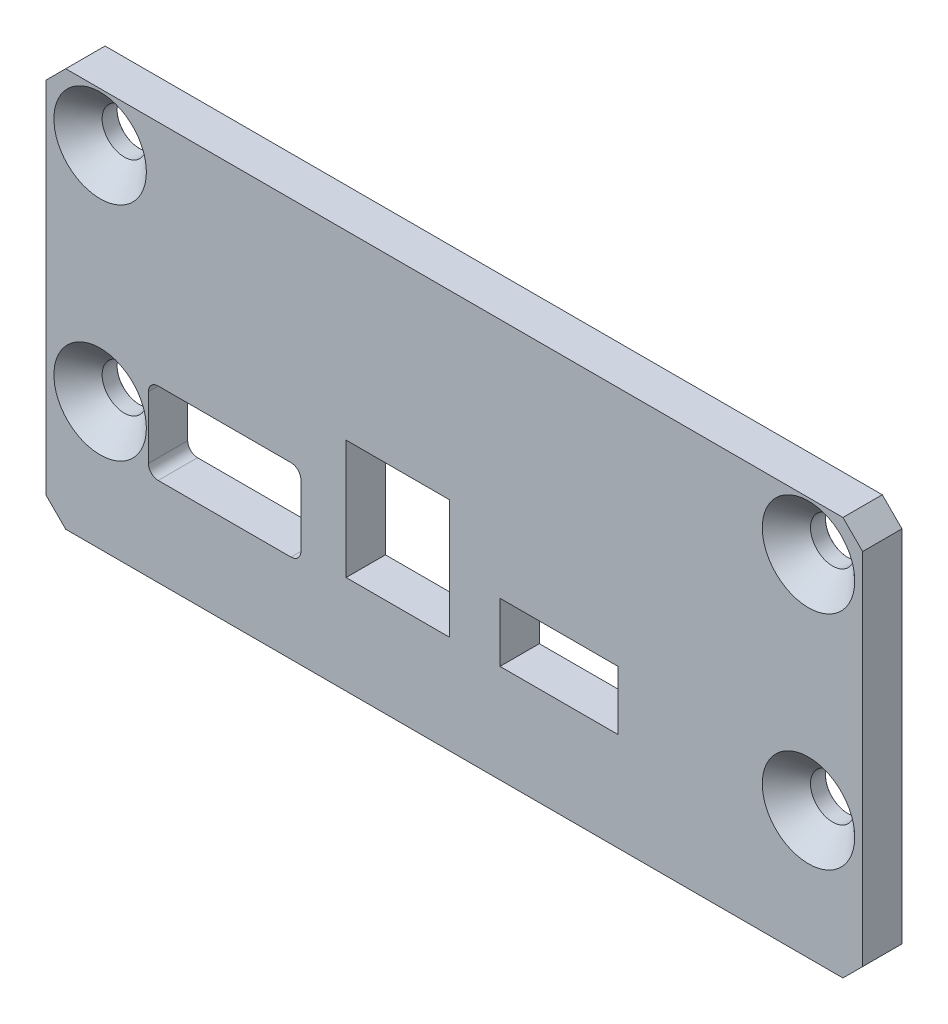
from build123d import *

# Parameters (mm, degrees)
ESQUISSE1_W                                 = 15.5
ESQUISSE1_H                                 = 8.312963114
ESQUISSE1_W_2                               = 10.5
ESQUISSE1_H_2                               = 12.1
ESQUISSE1_W_3                               = 12
ESQUISSE1_H_3                               = 6
BOSS_EXTRU_1_DEPTH                          = 4
FRAISAGE_POUR_VIS_T_TE_FRAIS_E_M41_AT_COUNT = 2
FRAISAGE_POUR_VIS_T_TE_FRAIS_E_M41_AT_PITCH = 22.54
FRAISAGE_POUR_VIS_T_TE_FRAIS_E_M41_2_COUNT  = 2
FRAISAGE_POUR_VIS_T_TE_FRAIS_E_M41_2_PITCH  = 75.445686424
FRAISAGE_POUR_VIS_T_TE_FRAIS_E_M41_3_COUNT  = 2
FRAISAGE_POUR_VIS_T_TE_FRAIS_E_M41_3_PITCH  = 72
CONG_1_R                                    = 1


with BuildPart() as part:
    # Esquisse1 → Boss.-Extru.1 (new body)
    with BuildSketch(Plane.XY):
        Polygon((-35.056497175, 38.54), (-35.056497175, 2), (-33.056497175, 0), (45.943502825, 0), (47.943502825, 2), (47.943502825, 38.54), (45.943502825, 40.54), (-33.056497175, 40.54), align=None)
        with Locations((-16.906497175, 13.156481557)):
            Rectangle(ESQUISSE1_W, ESQUISSE1_H, mode=Mode.SUBTRACT)
        with Locations((0.693502825, 16.05)):
            Rectangle(ESQUISSE1_W_2, ESQUISSE1_H_2, mode=Mode.SUBTRACT)
        with Locations((17.086336796, 13)):
            Rectangle(ESQUISSE1_W_3, ESQUISSE1_H_3, mode=Mode.SUBTRACT)
    extrude(amount=BOSS_EXTRU_1_DEPTH)

    # Esquisse4 → Fraisage pour vis à tête fraisée M41 (revolve, cut)
    with BuildSketch(Plane(origin=(-29.556497175, 35.54, 4), x_dir=(0, -1, 0), z_dir=(1, 0, 0))):
        Polygon((0, 0), (0, 4), (2.275, 4), (2.25, 3.975), (2.25, 2.45), (4.7, 0), align=None)
    fraisage_pour_vis_t_te_frais_e_m41 = revolve(axis=Axis((-29.556497175, 35.54, 10.35), (0, 0, -1)), mode=Mode.SUBTRACT)

    # Fraisage pour vis à tête fraisée M41 at: Fraisage pour vis à tête fraisée M41 ×2
    with Locations(*[(0, -i * FRAISAGE_POUR_VIS_T_TE_FRAIS_E_M41_AT_PITCH, 0) for i in range(1, FRAISAGE_POUR_VIS_T_TE_FRAIS_E_M41_AT_COUNT)]):
        add(fraisage_pour_vis_t_te_frais_e_m41, mode=Mode.SUBTRACT)

    # Fraisage pour vis _ t_te frais_e M41 2: Fraisage pour vis à tête fraisée M41 ×2
    with Locations(*[Vector(0.9543289141183242, -0.29875796839204205, 0) * (i * FRAISAGE_POUR_VIS_T_TE_FRAIS_E_M41_2_PITCH) for i in range(1, FRAISAGE_POUR_VIS_T_TE_FRAIS_E_M41_2_COUNT)]):
        add(fraisage_pour_vis_t_te_frais_e_m41, mode=Mode.SUBTRACT)

    # Fraisage pour vis _ t_te frais_e M41 3: Fraisage pour vis à tête fraisée M41 ×2
    with Locations(*[(i * FRAISAGE_POUR_VIS_T_TE_FRAIS_E_M41_3_PITCH, 0, 0) for i in range(1, FRAISAGE_POUR_VIS_T_TE_FRAIS_E_M41_3_COUNT)]):
        add(fraisage_pour_vis_t_te_frais_e_m41, mode=Mode.SUBTRACT)

    # Congé1
    cong_1_edges = [part.edges().sort_by_distance(p)[0] for p in [
        (-24.656497175, 17.312963114, 2),
        (-24.656497175, 9, 2),
        (-9.156497175, 9, 2),
        (-9.156497175, 17.312963114, 2),
    ]]
    fillet(cong_1_edges, radius=CONG_1_R)


solid = part.part
